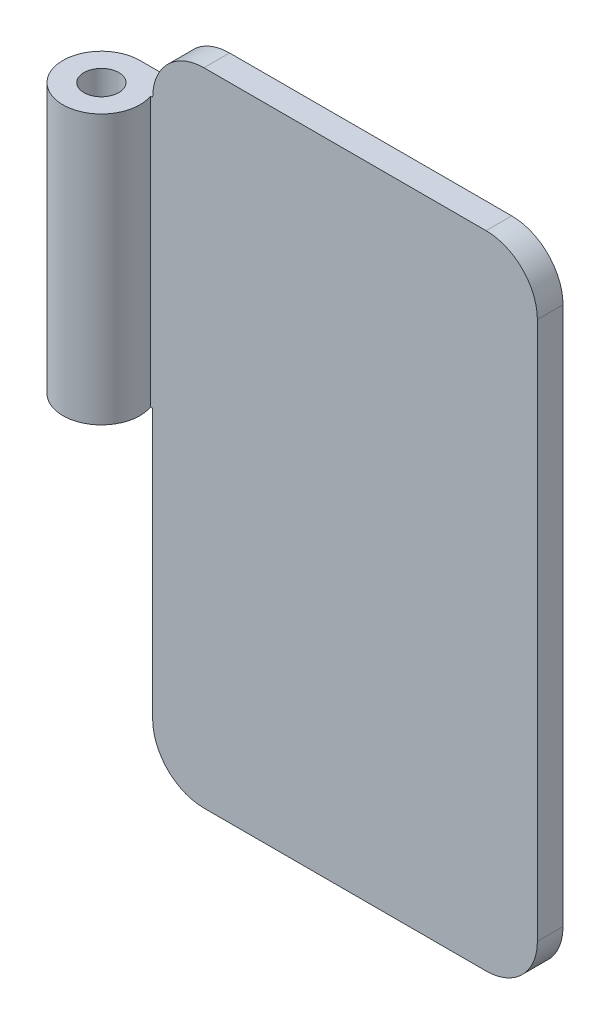
from build123d import *

# Parameters (mm, degrees)
EXTRUDE_1_DEPTH = 1
SKETCH_9_W      = 0.82
SKETCH_9_H      = 10.5
EXTRUDE_4_DEPTH = 10.5


with BuildPart() as part:
    # 草图1 → 凸台-拉伸1 (new body)
    with BuildSketch(Plane.XY):
        with BuildLine():
            Line((17.75, -8.875), (6.75, -8.875))
            ThreePointArc((6.75, -8.875), (5.335786438, -8.289213562), (4.75, -6.875))
            Line((4.75, -6.875), (4.75, 14.125))
            ThreePointArc((4.75, 14.125), (5.335786438, 15.539213562), (6.75, 16.125))
            Line((6.75, 16.125), (17.75, 16.125))
            ThreePointArc((17.75, 16.125), (19.164213562, 15.539213562), (19.75, 14.125))
            Line((19.75, 14.125), (19.75, -6.875))
            ThreePointArc((19.75, -6.875), (19.164213562, -8.289213562), (17.75, -8.875))
        make_face()
    extrude(amount=EXTRUDE_1_DEPTH)



with BuildPart() as body_2:
    # 草图9 → 旋转2 (revolve)
    with BuildSketch(Plane.XY.offset(1.5), mode=Mode.PRIVATE) as revolve_2_sk:
        with Locations((4.34, 8.875)):
            Rectangle(SKETCH_9_W, SKETCH_9_H)
    revolve(revolve_2_sk.sketch.rotate(Axis((3.25, 14.125, 1.5), (0, -1, 0)), 180), axis=Axis((3.25, 14.125, 1.5), (0, -1, 0)))


with BuildPart() as part_1:
    add(part.part)

    add(body_2.part)  # 凸台-拉伸4 merges body 2
    # 草图11 → 凸台-拉伸4 (add)
    with BuildSketch(Plane(origin=(0, 14.125, 0), x_dir=(1, 0, 0), z_dir=(0, 1, 0))):
        with BuildLine():
            Line((4.75, -1), (4.75, -0.82))
            Line((4.75, -0.82), (4.587011593, -0.82))
            ThreePointArc((4.587011593, -0.82), (4.628553577, -0.908738606), (4.664213562, -1))
            Line((4.664213562, -1), (4.75, -1))
        make_face()
        with BuildLine():
            Line((4.75, -0.82), (4.75, 0))
            Line((4.75, 0), (3.25, 0))
            ThreePointArc((3.25, 0), (4.034219357, -0.221328815), (4.587011593, -0.82))
            Line((4.587011593, -0.82), (4.75, -0.82))
        make_face()
    extrude(amount=-EXTRUDE_4_DEPTH)


solid = part_1.part
